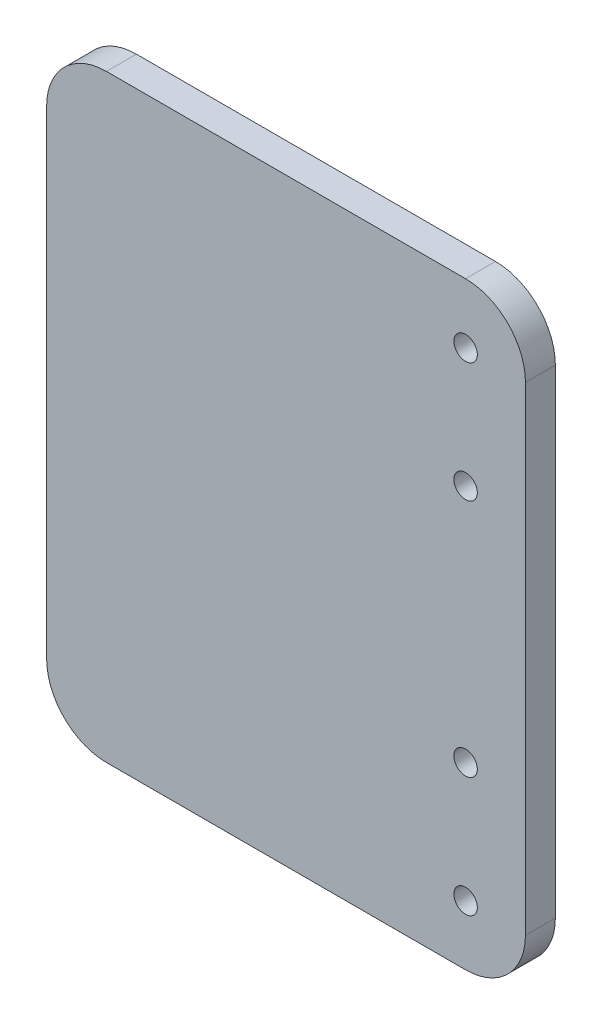
from build123d import *

# Parameters (mm, degrees)
SKETCH1_W                  = 127
SKETCH1_H                  = 101.6
BOSS_EXTRUDE1_DEPTH        = 6.35
F_9_0_196_DIAMETER_HOLE1_D = 4.9784
FILLET1_R                  = 12.7


with BuildPart() as part:
    # Sketch1 → Boss-Extrude1 (new body)
    with BuildSketch(Plane(origin=(0, 0, 0), x_dir=(0, 1, 0), z_dir=(0, 0, 1))):
        Rectangle(SKETCH1_W, SKETCH1_H)
    extrude(amount=BOSS_EXTRUDE1_DEPTH)

    # #9 (0.196) Diameter Hole1 (through all)
    with Locations(Plane.XY.offset(6.35)):
        with Locations((38.1, -50.8), (38.1, -25.4), (38.1, 25.4), (38.1, 50.8)):
            Hole(F_9_0_196_DIAMETER_HOLE1_D / 2)

    # Fillet1
    fillet1_edges = [part.edges().sort_by_distance(p)[0] for p in [
        (50.8, 63.5, 3.175),
        (50.8, -63.5, 3.175),
        (-50.8, -63.5, 3.175),
        (-50.8, 63.5, 3.175),
    ]]
    fillet(fillet1_edges, radius=FILLET1_R)


solid = part.part
